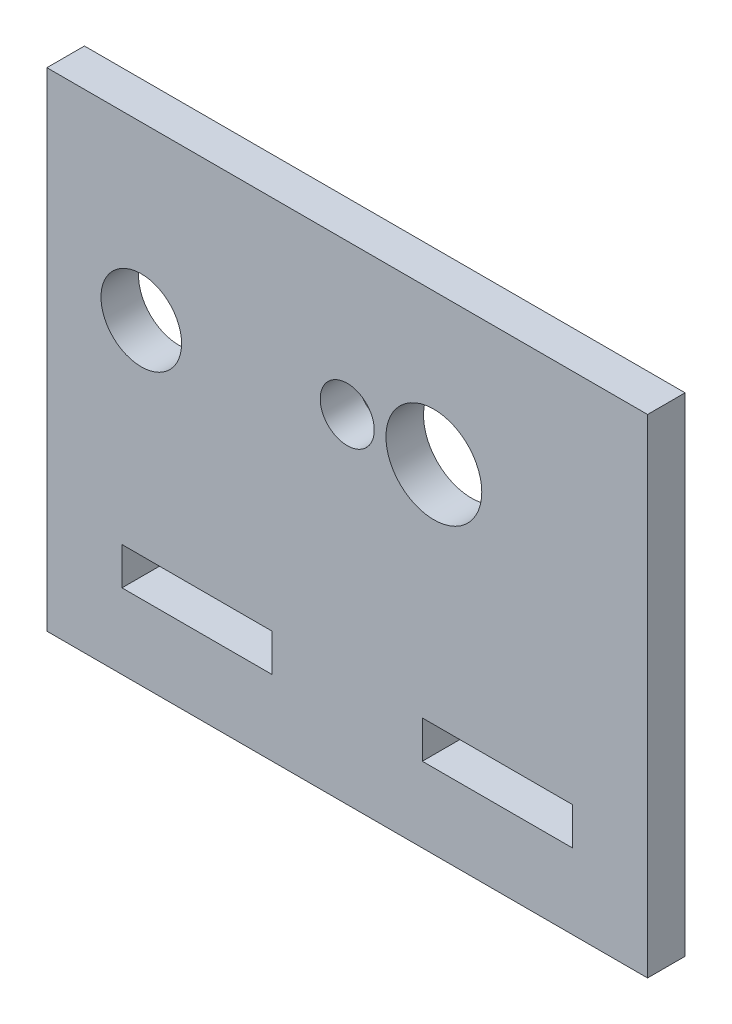
from build123d import *

# Parameters (mm, degrees)
SKETCH1_W           = 50.8
SKETCH1_H           = 41.275
SKETCH1_R           = 2.286
SKETCH1_R_2         = 3.407671893
SKETCH1_R_3         = 4.051699908
SKETCH1_W_2         = 12.7
SKETCH1_H_2         = 3.175
BOSS_EXTRUDE1_DEPTH = 3.175


with BuildPart() as part:
    # Sketch1 → Boss-Extrude1 (new body)
    with BuildSketch(Plane.XY):
        with Locations((25.4, 20.6375)):
            Rectangle(SKETCH1_W, SKETCH1_H)
        with Locations((25.4, 28.575)):
            Circle(SKETCH1_R, mode=Mode.SUBTRACT)
        with Locations((7.98153171, 26.761776277)):
            Circle(SKETCH1_R_2, mode=Mode.SUBTRACT)
        with Locations((32.727276231, 28.575)):
            Circle(SKETCH1_R_3, mode=Mode.SUBTRACT)
        with Locations((12.7, 7.9375)):
            Rectangle(SKETCH1_W_2, SKETCH1_H_2, mode=Mode.SUBTRACT)
        with Locations((38.1, 7.9375)):
            Rectangle(SKETCH1_W_2, SKETCH1_H_2, mode=Mode.SUBTRACT)
    extrude(amount=BOSS_EXTRUDE1_DEPTH)


solid = part.part
